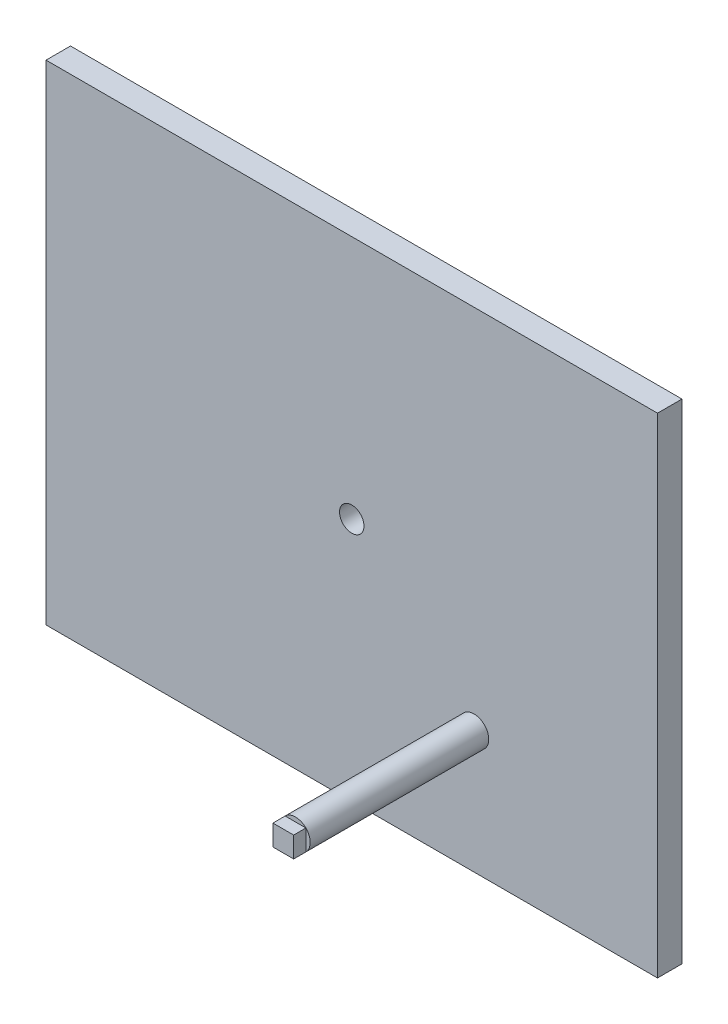
from build123d import *

# Parameters (mm, degrees)
SKETCH_1_W      = 2500
SKETCH_1_H      = 2000
SKETCH_1_R      = 50
EXTRUDE_1_DEPTH = 100
SKETCH_2_R      = 60
EXTRUDE_2_DEPTH = 730
SKETCH_3_W      = 84.852813742
SKETCH_3_H      = 84.852813742
EXTRUDE_3_DEPTH = 50


with BuildPart() as part:
    # 草图1 → 凸台-拉伸1 (new body)
    with BuildSketch(Plane.XY):
        Rectangle(SKETCH_1_W, SKETCH_1_H)
        Circle(SKETCH_1_R, mode=Mode.SUBTRACT)
    extrude(amount=EXTRUDE_1_DEPTH)

    # 草图2 → 凸台-拉伸2 (add)
    with BuildSketch(Plane.XY.offset(100)):
        with Locations(Location((500, -500, 0), (0, 0, 180))):
            Circle(SKETCH_2_R)
    extrude(amount=EXTRUDE_2_DEPTH)

    # 草图3 → 凸台-拉伸3 (add)
    with BuildSketch(Plane.XY.offset(830)):
        with Locations((500, -500)):
            Rectangle(SKETCH_3_W, SKETCH_3_H)
    extrude(amount=EXTRUDE_3_DEPTH)


solid = part.part
